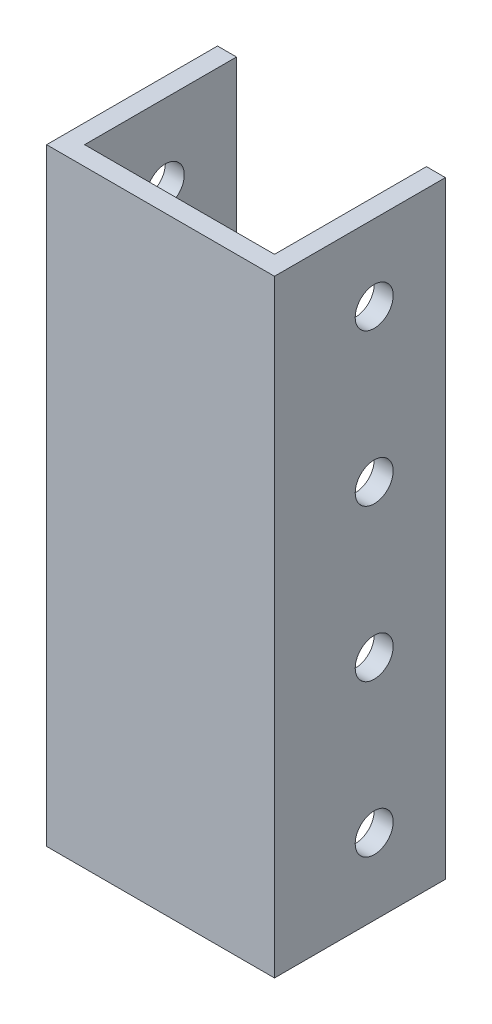
from build123d import *

# Parameters (mm, degrees)
BOSS_EXTRUDE1_DEPTH = 101.6
SKETCH3_R           = 3.175
CUT_EXTRUDE1_DEPTH  = 113.208291249


with BuildPart() as part:
    # Sketch1 → Boss-Extrude1 (new body)
    with BuildSketch(Plane(origin=(0, 0, 0), x_dir=(1, 0, 0), z_dir=(0, 1, 0))):
        Polygon((0, 0), (0, 28.575), (3.175, 28.575), (3.175, 3.175), (34.925, 3.175), (34.925, 28.575), (38.1, 28.575), (38.1, 0), align=None)
    extrude(amount=BOSS_EXTRUDE1_DEPTH)

    # Sketch3 → Cut-Extrude1 (cut, through all)
    with BuildSketch(Plane.ZY):
        with Locations((-16.66875, 12.7)):
            Circle(SKETCH3_R)
        with Locations((-16.66875, 38.1)):
            Circle(SKETCH3_R)
        with Locations((-16.66875, 63.5)):
            Circle(SKETCH3_R)
        with Locations((-16.66875, 88.9)):
            Circle(SKETCH3_R)
    extrude(amount=-CUT_EXTRUDE1_DEPTH, mode=Mode.SUBTRACT)


solid = part.part
